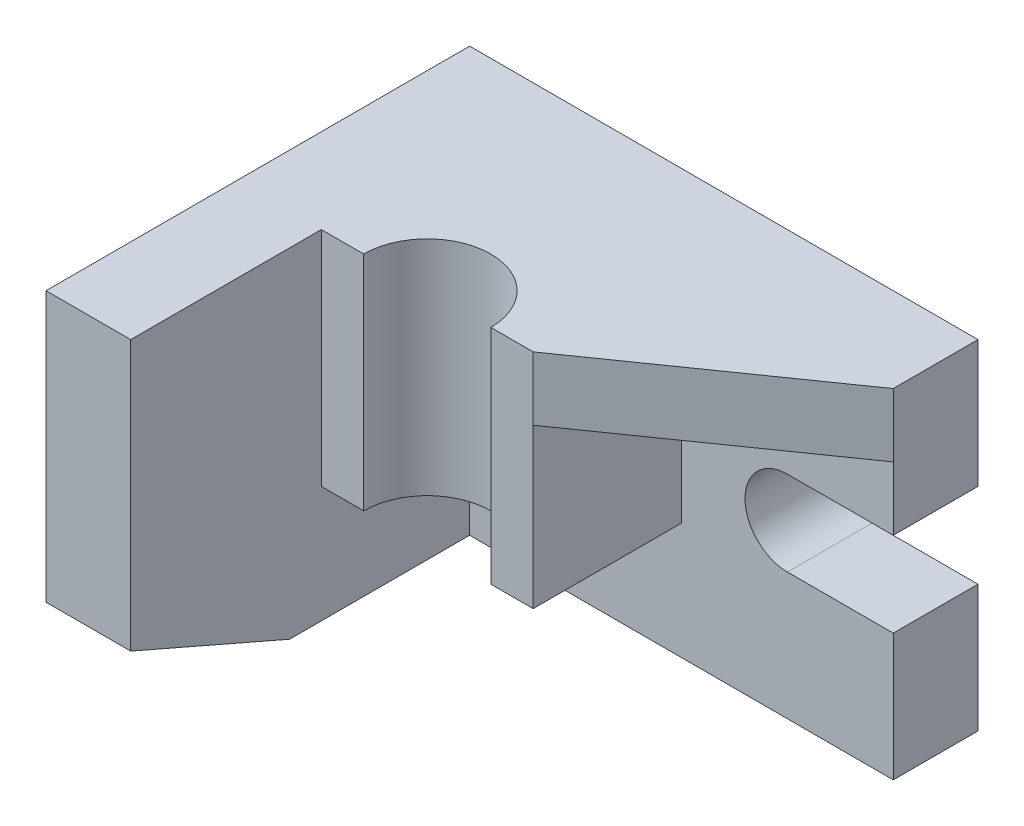
from build123d import *

# Parameters (mm, degrees)
SKETCH1_W               = 96
SKETCH1_H               = 64
BOSS_EXTRUDE1_DEPTH     = 16
BOSS_EXTRUDE2_DEPTH     = 16
SKETCH3_W               = 40
SKETCH3_H               = 28
BOSS_EXTRUDE3_DEPTH     = 42
BOSS_EXTRUDE4_DEPTH     = 12
CUT_EXTRUDE1_DEPTH      = 87.162636914
CUT_EXTRUDE1_DEPTH_BACK = 87.162636914
SKETCH6_R               = 12
CUT_EXTRUDE2_DEPTH      = 103.449987799


with BuildPart() as part:
    # Sketch1 → Boss-Extrude1 (new body)
    with BuildSketch(Plane.XY):
        Rectangle(SKETCH1_W, SKETCH1_H)
    extrude(amount=-BOSS_EXTRUDE1_DEPTH)

    # Sketch2 → Boss-Extrude2 (add)
    with BuildSketch(Plane.ZY.offset(48)):
        Polygon((0, 32), (64, 32), (64, -18.946257373), (34, -32), (0, -32), align=None)
    extrude(amount=-BOSS_EXTRUDE2_DEPTH)

    # Sketch3 → Boss-Extrude3 (add)
    with BuildSketch(Plane(origin=(0, 32, 0), x_dir=(1, 0, 0), z_dir=(0, 1, 0))):
        with Locations((-12, -14)):
            Rectangle(SKETCH3_W, SKETCH3_H)
    extrude(amount=-BOSS_EXTRUDE3_DEPTH)

    # Sketch4 → Boss-Extrude4 (add)
    with BuildSketch(Plane(origin=(0, 32, 0), x_dir=(1, 0, 0), z_dir=(0, 1, 0))):
        Polygon((8, -28), (48, 0), (8, 0), align=None)
    extrude(amount=-BOSS_EXTRUDE4_DEPTH)

    # Sketch5 → Cut-Extrude1 (cut, two sides: drawn at the far end of the back side and taken through both)
    with BuildSketch(Plane.XY.offset(-CUT_EXTRUDE1_DEPTH_BACK)):
        with BuildLine():
            Line((48, -8), (48, 8))
            Line((48, 8), (28, 8))
            ThreePointArc((28, 8), (20, 0), (28, -8))
            Line((28, -8), (48, -8))
        make_face()
    extrude(amount=CUT_EXTRUDE1_DEPTH + CUT_EXTRUDE1_DEPTH_BACK, mode=Mode.SUBTRACT)

    # Sketch6 → Cut-Extrude2 (cut, through all)
    with BuildSketch(Plane(origin=(0, 32, 0), x_dir=(1, 0, 0), z_dir=(0, 1, 0))):
        with Locations((-12, -28)):
            Circle(SKETCH6_R)
    extrude(amount=-CUT_EXTRUDE2_DEPTH, mode=Mode.SUBTRACT)


solid = part.part
